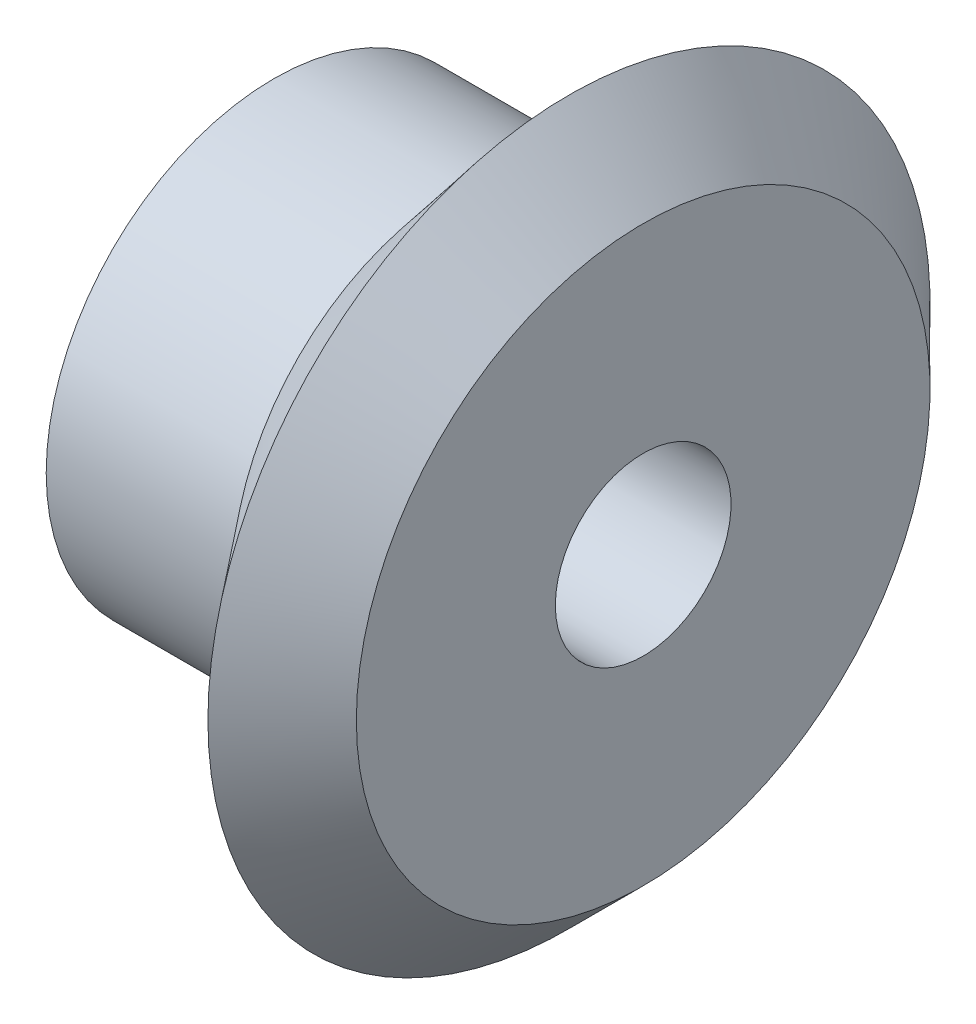
from build123d import *


with BuildPart() as part:
    # Sketch1 → Revolve1 (revolve)
    with BuildSketch(Plane.XY, mode=Mode.PRIVATE) as revolve1_sk:
        Polygon((4.843261506, 8), (2.773261506, 10.07), (-0.266738494, 6.35), (-5.456738494, 6.35), (-5.456738494, 2.45), (4.843261506, 2.45), align=None)
    revolve(revolve1_sk.sketch.rotate(Axis((-22.261648433, 0, 0), (1, 0, 0)), 90), axis=Axis((-22.261648433, 0, 0), (1, 0, 0)))


solid = part.part
